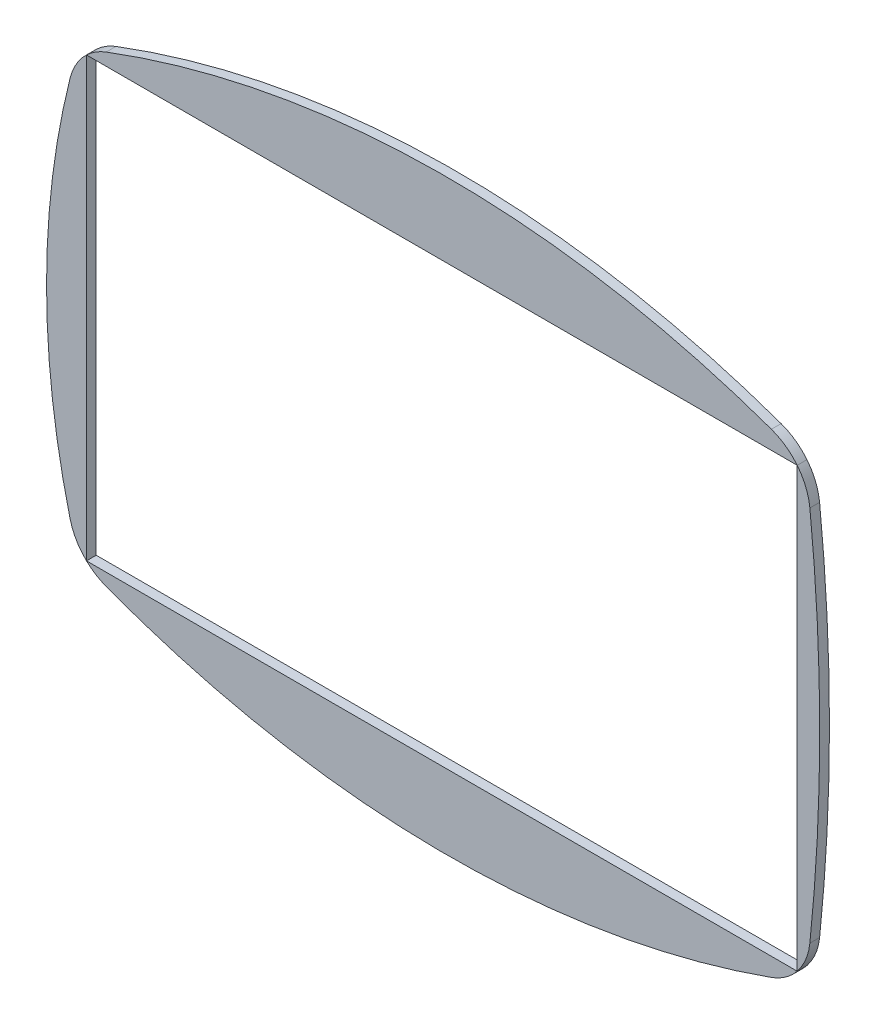
from build123d import *

# Parameters (mm, degrees)
BOSS_EXTRUDE1_DEPTH = 3


with BuildPart() as part:
    # Sketch1 → Boss-Extrude1 (new body)
    with BuildSketch(Plane.XY):
        with BuildLine():
            Line((-216, -5), (-216, 130))
            ThreePointArc((-216, 130), (-219.128091815, 126.036253786), (-221.032182674, 121.359643853))
            ThreePointArc((-221.032182674, 121.359643853), (-228.306620217, 62.5), (-221.032182674, 3.640356147))
            ThreePointArc((-221.032182674, 3.640356147), (-219.128091815, -1.036253786), (-216, -5))
        make_face()
        with BuildLine():
            Line((-153, -5), (-156, -5))
            Line((-156, -5), (-216, -5))
            ThreePointArc((-216, -5), (-213.154704, -7.215664753), (-209.924844222, -8.819686401))
            ThreePointArc((-209.924844222, -8.819686401), (-107.602254406, -27.942305472), (-4.95523653, -10.645581267))
            ThreePointArc((-4.95523653, -10.645581267), (-0.587882217, -8.37197101), (3, -5))
            Line((3, -5), (-56.661530308, -5))
            Line((-56.661530308, -5), (-116.661530308, -5))
            Line((-116.661530308, -5), (-153, -5))
        make_face()
        with BuildLine():
            Line((-156, 130), (-153, 130))
            Line((-153, 130), (3, 130))
            ThreePointArc((3, 130), (-0.587882217, 133.37197101), (-4.95523653, 135.645581267))
            ThreePointArc((-4.95523653, 135.645581267), (-107.602254406, 152.942305472), (-209.924844222, 133.819686401))
            ThreePointArc((-209.924844222, 133.819686401), (-213.154704, 132.215664753), (-216, 130))
            Line((-216, 130), (-156, 130))
        make_face()
        with BuildLine():
            Line((9.931140136, 62.5), (3, 62.5))
            Line((3, 62.5), (3, -2))
            Line((3, -2), (3, -5))
            ThreePointArc((3, -5), (5.630685427, -0.566348055), (6.896722896, 4.431143767))
            ThreePointArc((6.896722896, 4.431143767), (9.172018663, 33.425957659), (9.931140136, 62.5))
        make_face()
        with BuildLine():
            ThreePointArc((6.896722896, 120.568856233), (5.630685427, 125.566348055), (3, 130))
            Line((3, 130), (3, 127))
            Line((3, 127), (3, 62.5))
            Line((3, 62.5), (9.931140136, 62.5))
            ThreePointArc((9.931140136, 62.5), (9.172018663, 91.574042341), (6.896722896, 120.568856233))
        make_face()
    extrude(amount=-BOSS_EXTRUDE1_DEPTH)


solid = part.part
